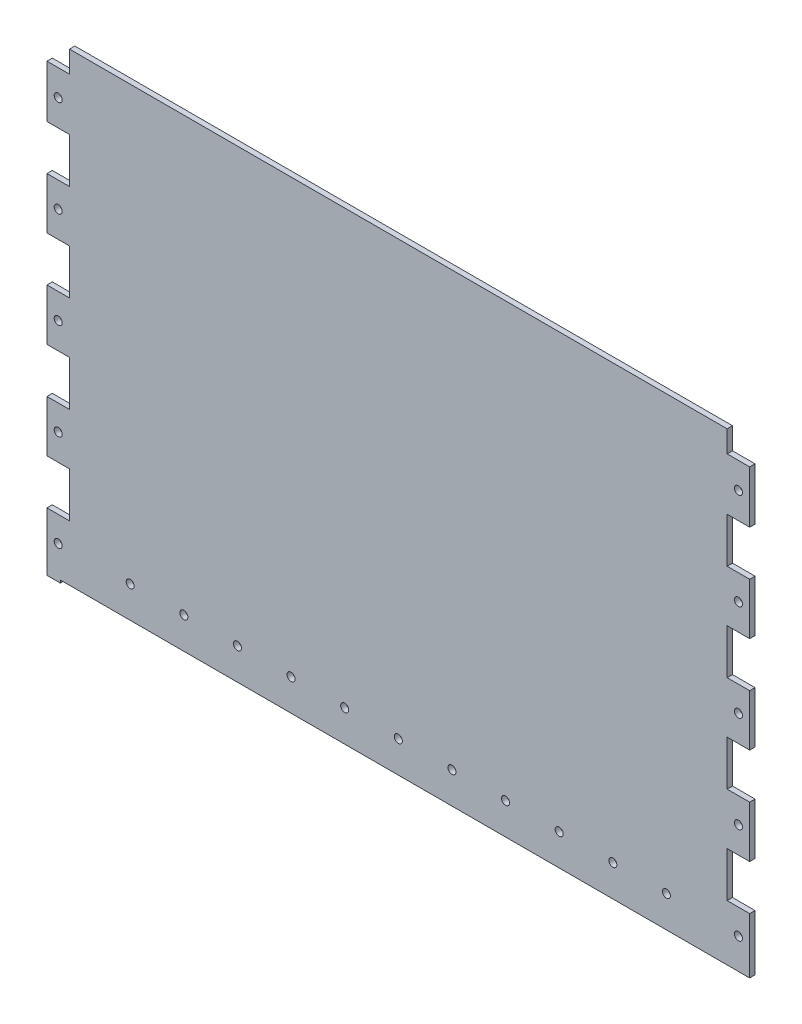
from build123d import *

# Parameters (mm, degrees)
SKETCH_1_W          = 262.1
SKETCH_1_H          = 166.2
EXTRUDE_1_DEPTH     = 1
SKETCH_2_R          = 1.5
SKETCH_2_W          = 8.4
SKETCH_2_H          = 16.8
SKETCH_2_W_2        = 262.1
SKETCH_2_H_2        = 0.2
SKETCH_2_W_3        = 257.1
SKETCH_2_H_3        = 1
CUT_EXTRUDE1_DEPTH  = 10
SKETCH1_R           = 1.5
CUT_EXTRUDE2_DEPTH  = 10
SKETCH2_W           = 245.3
SKETCH2_H           = 8.1
BOSS_EXTRUDE1_DEPTH = 2


with BuildPart() as part:
    # 草图1 → 凸台-拉伸1 (new, symmetric)
    with BuildSketch(Plane.XY):
        Rectangle(SKETCH_1_W, SKETCH_1_H)
    extrude(amount=EXTRUDE_1_DEPTH, both=True)

    # 草图2 → Cut-Extrude1 (cut)
    with BuildSketch(Plane.XY.offset(1)):
        with Locations((-126.85, 73.3)):
            Circle(SKETCH_2_R)
        with Locations((-126.85, 37.3)):
            Circle(SKETCH_2_R)
        with Locations((-126.85, 1.3)):
            Circle(SKETCH_2_R)
        with Locations((-126.85, -34.7)):
            Circle(SKETCH_2_R)
        with Locations((-126.85, -70.7)):
            Circle(SKETCH_2_R)
        with Locations((126.85, -70.7)):
            Circle(SKETCH_2_R)
        with Locations((126.85, -34.7)):
            Circle(SKETCH_2_R)
        with Locations((126.85, 1.3)):
            Circle(SKETCH_2_R)
        with Locations((126.85, 37.3)):
            Circle(SKETCH_2_R)
        with Locations((126.85, 73.3)):
            Circle(SKETCH_2_R)
        with Locations((-126.85, 55.1)):
            Rectangle(SKETCH_2_W, SKETCH_2_H)
        with Locations((-126.85, 19.1)):
            Rectangle(SKETCH_2_W, SKETCH_2_H)
        with Locations((-126.85, -16.9)):
            Rectangle(SKETCH_2_W, SKETCH_2_H)
        with Locations((-126.85, -52.9)):
            Rectangle(SKETCH_2_W, SKETCH_2_H)
        with Locations((126.85, -52.9)):
            Rectangle(SKETCH_2_W, SKETCH_2_H)
        with Locations((126.85, -16.9)):
            Rectangle(SKETCH_2_W, SKETCH_2_H)
        with Locations((126.85, 19.1)):
            Rectangle(SKETCH_2_W, SKETCH_2_H)
        with Locations((126.85, 55.1)):
            Rectangle(SKETCH_2_W, SKETCH_2_H)
        with Locations((0, 83.089141708)):
            Rectangle(SKETCH_2_W_2, SKETCH_2_H_2)
        with Locations((2.5, -82.6)):
            Rectangle(SKETCH_2_W_3, SKETCH_2_H_3)
    extrude(amount=-CUT_EXTRUDE1_DEPTH, mode=Mode.SUBTRACT)

    # Sketch1 → Cut-Extrude2 (cut)
    with BuildSketch(Plane.XY.offset(1)):
        with Locations((100, -70.35)):
            Circle(SKETCH1_R)
        with Locations((80, -70.35)):
            Circle(SKETCH1_R)
        with Locations((60, -70.35)):
            Circle(SKETCH1_R)
        with Locations((40, -70.35)):
            Circle(SKETCH1_R)
        with Locations((20, -70.35)):
            Circle(SKETCH1_R)
        with Locations((0, -70.35)):
            Circle(SKETCH1_R)
        with Locations((-20, -70.35)):
            Circle(SKETCH1_R)
        with Locations((-40, -70.35)):
            Circle(SKETCH1_R)
        with Locations((-60, -70.35)):
            Circle(SKETCH1_R)
        with Locations((-80, -70.35)):
            Circle(SKETCH1_R)
        with Locations((-100, -70.35)):
            Circle(SKETCH1_R)
    extrude(amount=-CUT_EXTRUDE2_DEPTH, mode=Mode.SUBTRACT)

    # Sketch2 → Boss-Extrude1 (add)
    with BuildSketch(Plane.XY.offset(1)):
        with Locations((0, 87.039141708)):
            Rectangle(SKETCH2_W, SKETCH2_H)
    extrude(amount=-BOSS_EXTRUDE1_DEPTH)


solid = part.part
